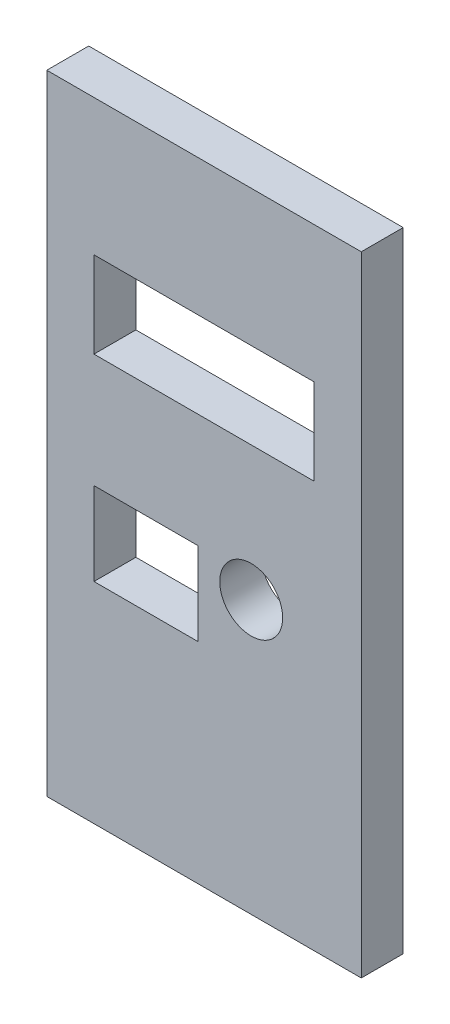
from build123d import *

# Parameters (mm, degrees)
SKETCH1_W           = 15
SKETCH1_H           = 30
BOSS_EXTRUDE1_DEPTH = 2
SKETCH2_W           = 10.5
SKETCH2_H           = 4.102887438
SKETCH2_W_2         = 4.953801424
SKETCH2_H_2         = 3.961570411
SKETCH2_R           = 1.5
CUT_EXTRUDE1_DEPTH  = 10


with BuildPart() as part:
    # Sketch1 → Boss-Extrude1 (new body)
    with BuildSketch(Plane.XY):
        Rectangle(SKETCH1_W, SKETCH1_H)
    extrude(amount=BOSS_EXTRUDE1_DEPTH)

    # Sketch2 → Cut-Extrude1 (cut)
    with BuildSketch(Plane.XY.offset(2)):
        with Locations((0, 6.448556281)):
            Rectangle(SKETCH2_W, SKETCH2_H)
        with Locations((-2.773099288, -3.015195258)):
            Rectangle(SKETCH2_W_2, SKETCH2_H_2)
        with Locations((2.25, -2)):
            Circle(SKETCH2_R)
    extrude(amount=-CUT_EXTRUDE1_DEPTH, mode=Mode.SUBTRACT)


solid = part.part
